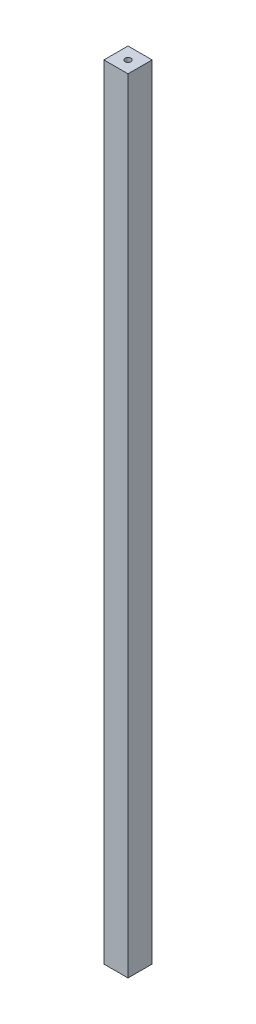
from build123d import *

# Parameters (mm, degrees)
SKETCH1_W           = 20
SKETCH1_H           = 20
BOSS_EXTRUDE1_DEPTH = 650
SKETCH2_R           = 2.5
CUT_EXTRUDE1_DEPTH  = 800


with BuildPart() as part:
    # Sketch1 → Boss-Extrude1 (new body)
    with BuildSketch(Plane(origin=(0, 0, 0), x_dir=(1, 0, 0), z_dir=(0, 1, 0))):
        Rectangle(SKETCH1_W, SKETCH1_H)
    extrude(amount=BOSS_EXTRUDE1_DEPTH)

    # Sketch2 → Cut-Extrude1 (cut)
    with BuildSketch(Plane(origin=(0, 650, 0), x_dir=(1, 0, 0), z_dir=(0, 1, 0))):
        with Locations(Location((0, 0, 0), (0, 0, 270))):
            Circle(SKETCH2_R)
    extrude(amount=-CUT_EXTRUDE1_DEPTH, mode=Mode.SUBTRACT)


solid = part.part
